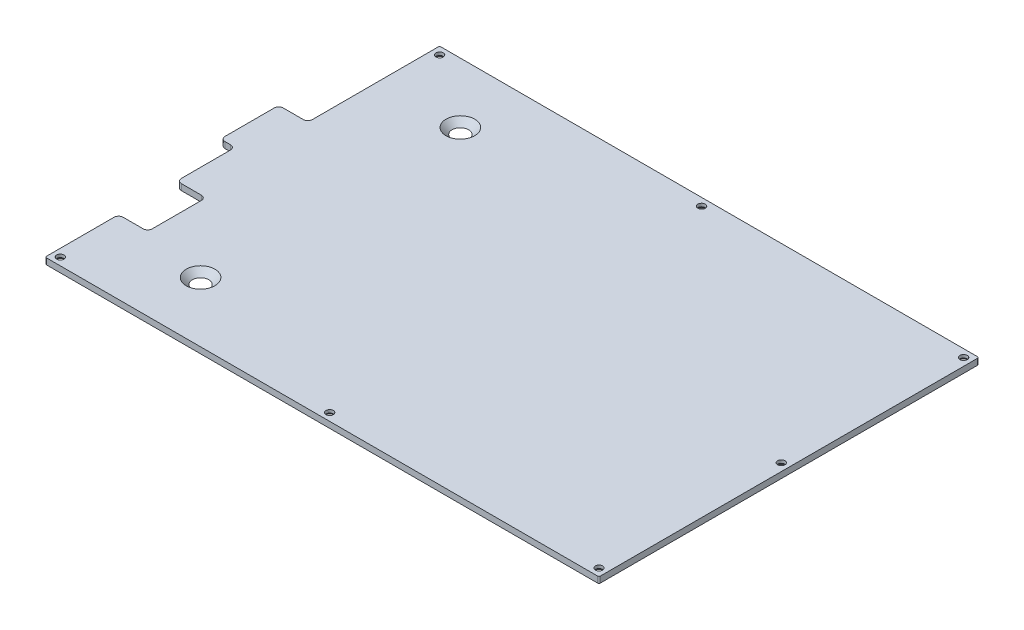
from build123d import *

# Parameters (mm, degrees)
PLATE_FRAME_DEPTH                              = 2
CSK_FOR_M2_FLAT_HEAD_MACHINE_SCREW1_AT_2_COUNT = 2
CSK_FOR_M2_FLAT_HEAD_MACHINE_SCREW1_AT_2_PITCH = 88.10625
CSK_FOR_M2_FLAT_HEAD_MACHINE_SCREW1_AT_3_COUNT = 2
CSK_FOR_M2_FLAT_HEAD_MACHINE_SCREW1_AT_3_PITCH = 176.2125
CSK_FOR_M2_FLAT_HEAD_MACHINE_SCREW1_AT_4_COUNT = 2
CSK_FOR_M2_FLAT_HEAD_MACHINE_SCREW1_AT_4_PITCH = 186.034856025
CSK_FOR_M2_FLAT_HEAD_MACHINE_SCREW1_AT_5_COUNT = 2
CSK_FOR_M2_FLAT_HEAD_MACHINE_SCREW1_AT_5_PITCH = 212.798813804
CSK_FOR_M2_FLAT_HEAD_MACHINE_SCREW1_AT_6_COUNT = 2
CSK_FOR_M2_FLAT_HEAD_MACHINE_SCREW1_AT_6_PITCH = 149.734690891
CSK_FOR_M2_FLAT_HEAD_MACHINE_SCREW1_AT_7_COUNT = 2
CSK_FOR_M2_FLAT_HEAD_MACHINE_SCREW1_AT_7_PITCH = 119.395022535
CSK_FOR_M4_FLAT_HEAD_MACHINE_SCREW1_AT_2_COUNT = 2
CSK_FOR_M4_FLAT_HEAD_MACHINE_SCREW1_AT_2_PITCH = 85
FILLET1_R                                      = 1.5
FILLET2_R                                      = 0.5


with BuildPart() as part:
    # Sketch1 → Plate Frame (new body)
    with BuildSketch(Plane(origin=(0, 0, 0), x_dir=(1, 0, 0), z_dir=(0, 1, 0))):
        Polygon((0, 0), (0, 124.3), (-176.45, 124.3), (-176.45, 81.2), (-185.975, 81.2), (-185.975, 62.15), (-181.2125, 62.15), (-181.2125, 43.1), (-171.6875, 43.1), (-171.6875, 24.05), (-181.2125, 24.05), (-181.2125, 0), align=None)
    extrude(amount=PLATE_FRAME_DEPTH)

    # Sketch4 → CSK for M2 Flat Head Machine Screw1 (revolve, cut)
    with BuildSketch(Plane(origin=(-178.7125, 0, -2.5), x_dir=(0, 0, -1), z_dir=(1, 0, 0))):
        Polygon((0, 0), (0, 2), (1.2, 2), (1.2, 1), (2.2, 0), align=None)
    csk_for_m2_flat_head_machine_screw1 = revolve(axis=Axis((-178.7125, -6.35, -2.5), (0, 1, 0)), mode=Mode.SUBTRACT)

    # CSK for M2 Flat Head Machine Screw1 at 2: CSK for M2 Flat Head Machine Screw1 ×2
    with Locations(*[(i * CSK_FOR_M2_FLAT_HEAD_MACHINE_SCREW1_AT_2_PITCH, 0, 0) for i in range(1, CSK_FOR_M2_FLAT_HEAD_MACHINE_SCREW1_AT_2_COUNT)]):
        add(csk_for_m2_flat_head_machine_screw1, mode=Mode.SUBTRACT)

    # CSK for M2 Flat Head Machine Screw1 at 3: CSK for M2 Flat Head Machine Screw1 ×2
    with Locations(*[(i * CSK_FOR_M2_FLAT_HEAD_MACHINE_SCREW1_AT_3_PITCH, 0, 0) for i in range(1, CSK_FOR_M2_FLAT_HEAD_MACHINE_SCREW1_AT_3_COUNT)]):
        add(csk_for_m2_flat_head_machine_screw1, mode=Mode.SUBTRACT)

    # CSK for M2 Flat Head Machine Screw1 at 4: CSK for M2 Flat Head Machine Screw1 ×2
    with Locations(*[Vector(0.9472015286011822, 0, -0.32063883765942) * (i * CSK_FOR_M2_FLAT_HEAD_MACHINE_SCREW1_AT_4_PITCH) for i in range(1, CSK_FOR_M2_FLAT_HEAD_MACHINE_SCREW1_AT_4_COUNT)]):
        add(csk_for_m2_flat_head_machine_screw1, mode=Mode.SUBTRACT)

    # CSK for M2 Flat Head Machine Screw1 at 5: CSK for M2 Flat Head Machine Screw1 ×2
    with Locations(*[Vector(0.828070875256726, 0, -0.5606234257962825) * (i * CSK_FOR_M2_FLAT_HEAD_MACHINE_SCREW1_AT_5_PITCH) for i in range(1, CSK_FOR_M2_FLAT_HEAD_MACHINE_SCREW1_AT_5_COUNT)]):
        add(csk_for_m2_flat_head_machine_screw1, mode=Mode.SUBTRACT)

    # CSK for M2 Flat Head Machine Screw1 at 6: CSK for M2 Flat Head Machine Screw1 ×2
    with Locations(*[Vector(0.6043188753487788, 0, -0.7967425537130468) * (i * CSK_FOR_M2_FLAT_HEAD_MACHINE_SCREW1_AT_6_PITCH) for i in range(1, CSK_FOR_M2_FLAT_HEAD_MACHINE_SCREW1_AT_6_COUNT)]):
        add(csk_for_m2_flat_head_machine_screw1, mode=Mode.SUBTRACT)

    # CSK for M2 Flat Head Machine Screw1 at 7: CSK for M2 Flat Head Machine Screw1 ×2
    with Locations(*[Vector(0.03988859752159598, 0, -0.9992041331918919) * (i * CSK_FOR_M2_FLAT_HEAD_MACHINE_SCREW1_AT_7_PITCH) for i in range(1, CSK_FOR_M2_FLAT_HEAD_MACHINE_SCREW1_AT_7_COUNT)]):
        add(csk_for_m2_flat_head_machine_screw1, mode=Mode.SUBTRACT)

    # Sketch7 → CSK for M4 Flat Head Machine Screw1 (revolve, cut)
    with BuildSketch(Plane(origin=(-150, 2, -104.65), x_dir=(0, 0, 1), z_dir=(1, 0, 0))):
        Polygon((0, 0), (0, 2), (2.25, 2), (2.25, 2.45), (4.7, 0), align=None)
    csk_for_m4_flat_head_machine_screw1 = revolve(axis=Axis((-150, 8.35, -104.65), (0, -1, 0)), mode=Mode.SUBTRACT)

    # CSK for M4 Flat Head Machine Screw1 at 2: CSK for M4 Flat Head Machine Screw1 ×2
    with Locations(*[(0, 0, i * CSK_FOR_M4_FLAT_HEAD_MACHINE_SCREW1_AT_2_PITCH) for i in range(1, CSK_FOR_M4_FLAT_HEAD_MACHINE_SCREW1_AT_2_COUNT)]):
        add(csk_for_m4_flat_head_machine_screw1, mode=Mode.SUBTRACT)

    # Fillet1
    fillet1_edges = [part.edges().sort_by_distance(p)[0] for p in [
        (-181.2125, 1, -24.05),
        (-171.6875, 1, -24.05),
        (-171.6875, 1, -43.1),
        (-181.2125, 1, -43.1),
        (-181.2125, 1, -62.15),
        (-185.975, 1, -62.15),
        (-185.975, 1, -81.2),
        (-176.45, 1, -81.2),
    ]]
    fillet(fillet1_edges, radius=FILLET1_R)

    # Fillet2
    fillet2_edges = [part.edges().sort_by_distance(p)[0] for p in [
        (-181.2125, 1, 0),
        (-176.45, 1, -124.3),
        (0, 1, -124.3),
        (0, 1, 0),
    ]]
    fillet(fillet2_edges, radius=FILLET2_R)


solid = part.part
